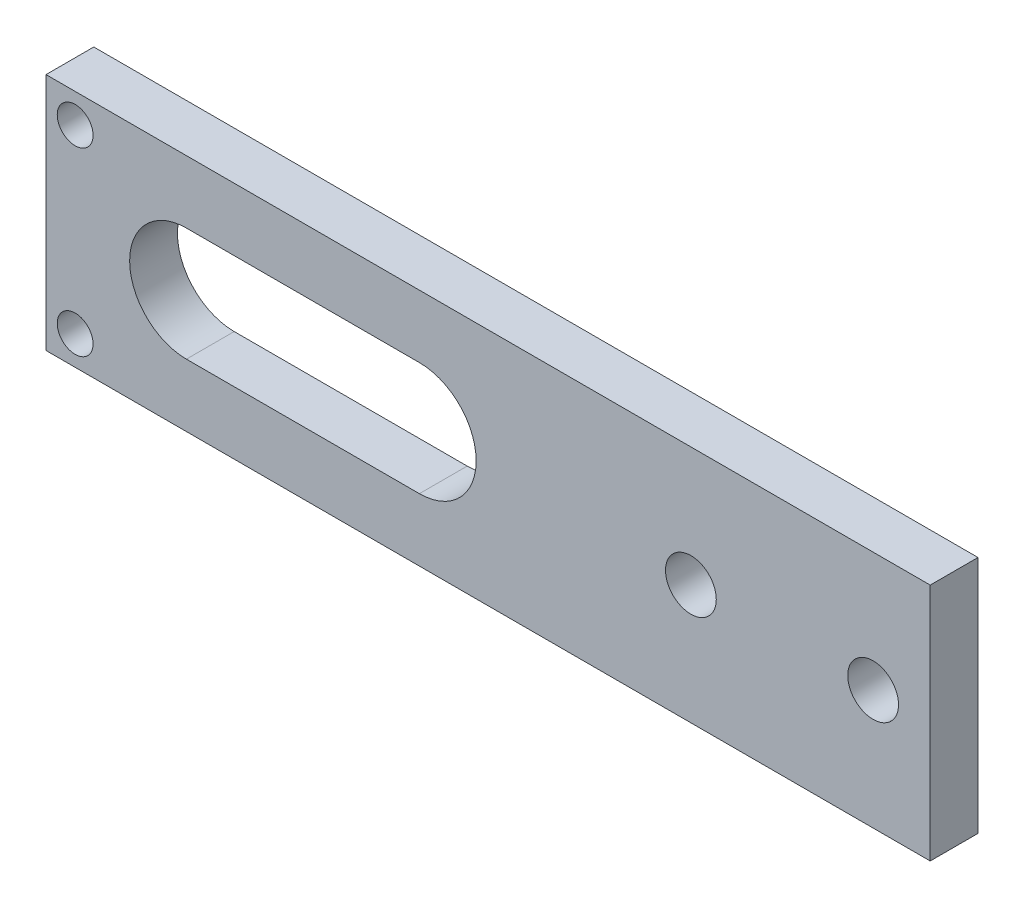
from build123d import *

# Parameters (mm, degrees)
SKETCH1_W           = 74
SKETCH1_H           = 20
SKETCH1_R           = 2.125
SKETCH1_R_2         = 1.5
BOSS_EXTRUDE1_DEPTH = 4


with BuildPart() as part:
    # Sketch1 → Boss-Extrude1 (new body)
    with BuildSketch(Plane.XY):
        Rectangle(SKETCH1_W, SKETCH1_H)
        with Locations((32.221854305, 0)):
            Circle(SKETCH1_R, mode=Mode.SUBTRACT)
        with Locations((16.971854305, 0)):
            Circle(SKETCH1_R, mode=Mode.SUBTRACT)
        with Locations((-34.559305938, -7.559305938)):
            Circle(SKETCH1_R_2, mode=Mode.SUBTRACT)
        with Locations(Location((-34.559305938, 7.559305938, 0), (0, 0, 180))):
            Circle(SKETCH1_R_2, mode=Mode.SUBTRACT)
        with BuildLine():
            Line((-25.25, 4.75), (-5.75, 4.75))
            ThreePointArc((-5.75, 4.75), (-1, 0), (-5.75, -4.75))
            Line((-5.75, -4.75), (-25.25, -4.75))
            ThreePointArc((-25.25, -4.75), (-30, 0), (-25.25, 4.75))
        make_face(mode=Mode.SUBTRACT)
    extrude(amount=BOSS_EXTRUDE1_DEPTH)


solid = part.part
